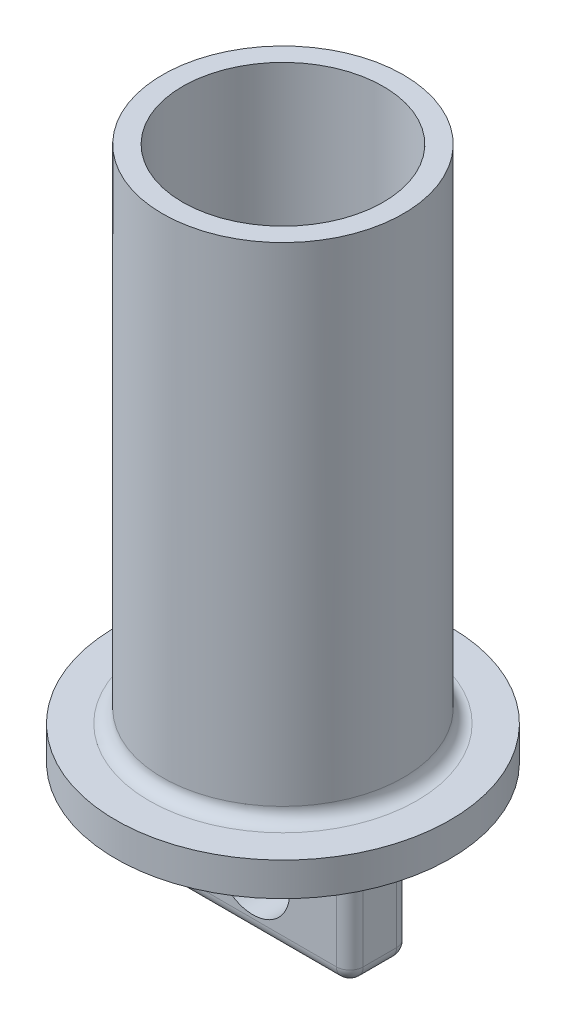
from build123d import *

# Parameters (mm, degrees)
SKETCH1_R            = 18
BOSS_EXTRUDE1_DEPTH  = 80
SKETCH1_3_R          = 15
SKETCH1_3_R_2        = 13
BOSS_EXTRUDE2_DEPTH  = 5
BOSS_EXTRUDE4_DEPTH  = 10
SKETCH3_R            = 25
SKETCH3_R_2          = 18
SKETCH3_R_3          = 13
BOSS_EXTRUDE6_DEPTH  = 5
SKETCH15_W           = 29
SKETCH15_H           = 9
BOSS_EXTRUDE13_DEPTH = 20
SKETCH16_R           = 5.5
CUT_EXTRUDE3_DEPTH   = 89.855219318
FILLET1_R            = 2


with BuildPart() as part:
    # Sketch1 → Boss-Extrude1 (new body)
    with BuildSketch(Plane(origin=(0, 0, 0), x_dir=(1, 0, 0), z_dir=(0, 1, 0))):
        Circle(SKETCH1_R)
        with BuildLine():
            ThreePointArc((-3.882285677, 14.488887394), (0, 15), (3.882285677, 14.488887394))
            ThreePointArc((3.882285677, 14.488887394), (10.606601718, 10.606601718), (14.488887394, 3.882285677))
            ThreePointArc((14.488887394, 3.882285677), (14.871672921, 1.957892883), (15, 0))
            ThreePointArc((15, 0), (14.871672921, -1.957892883), (14.488887394, -3.882285677))
            ThreePointArc((14.488887394, -3.882285677), (10.606601718, -10.606601718), (3.882285677, -14.488887394))
            ThreePointArc((3.882285677, -14.488887394), (0, -15), (-3.882285677, -14.488887394))
            ThreePointArc((-3.882285677, -14.488887394), (-10.606601718, -10.606601718), (-14.488887394, -3.882285677))
            ThreePointArc((-14.488887394, -3.882285677), (-15, 0), (-14.488887394, 3.882285677))
            ThreePointArc((-14.488887394, 3.882285677), (-10.606601718, 10.606601718), (-3.882285677, 14.488887394))
        make_face(mode=Mode.SUBTRACT)
    extrude(amount=BOSS_EXTRUDE1_DEPTH)

    # Sketch1<3> → Boss-Extrude2 (add)
    with BuildSketch(Plane(origin=(0, 0, 0), x_dir=(1, 0, 0), z_dir=(0, 1, 0))):
        Circle(SKETCH1_3_R)
        Circle(SKETCH1_3_R_2, mode=Mode.SUBTRACT)
    extrude(amount=BOSS_EXTRUDE2_DEPTH)

    # Sketch1<4> → Boss-Extrude4 (add)
    with BuildSketch(Plane(origin=(0, 0, 0), x_dir=(1, 0, 0), z_dir=(0, 1, 0))):
        with BuildLine():
            Line((3.364647586, 12.557035742), (3.882285677, 14.488887394))
            ThreePointArc((3.882285677, 14.488887394), (0, 15), (-3.882285677, 14.488887394))
            Line((-3.882285677, 14.488887394), (-3.364647586, 12.557035742))
            ThreePointArc((-3.364647586, 12.557035742), (0, 13), (3.364647586, 12.557035742))
        make_face()
        with BuildLine():
            ThreePointArc((14.488887394, -3.882285677), (15, 0), (14.488887394, 3.882285677))
            Line((14.488887394, 3.882285677), (12.557035742, 3.364647586))
            ThreePointArc((12.557035742, 3.364647586), (13, 0), (12.557035742, -3.364647586))
            Line((12.557035742, -3.364647586), (14.488887394, -3.882285677))
        make_face()
        with BuildLine():
            Line((-12.557035742, 3.364647586), (-14.488887394, 3.882285677))
            ThreePointArc((-14.488887394, 3.882285677), (-15, 0), (-14.488887394, -3.882285677))
            Line((-14.488887394, -3.882285677), (-12.557035742, -3.364647586))
            ThreePointArc((-12.557035742, -3.364647586), (-13, 0), (-12.557035742, 3.364647586))
        make_face()
        with BuildLine():
            ThreePointArc((-3.882285677, -14.488887394), (0, -15), (3.882285677, -14.488887394))
            Line((3.882285677, -14.488887394), (3.364647586, -12.557035742))
            ThreePointArc((3.364647586, -12.557035742), (0, -13), (-3.364647586, -12.557035742))
            Line((-3.364647586, -12.557035742), (-3.882285677, -14.488887394))
        make_face()
    extrude(amount=BOSS_EXTRUDE4_DEPTH)

    # Sketch3 → Boss-Extrude6 (add)
    # profile 1 of 2: a face of its own
    with BuildSketch(Plane.XZ):
        Circle(SKETCH3_R)
        Circle(SKETCH3_R_2, mode=Mode.SUBTRACT)
    # profile 2 of 2: a face of its own
    with BuildSketch(Plane.XZ):
        Circle(SKETCH3_R_3)
    extrude(amount=-BOSS_EXTRUDE6_DEPTH)

    # Sketch15 → Boss-Extrude13 (add)
    with BuildSketch(Plane.XZ):
        Rectangle(SKETCH15_W, SKETCH15_H)
    extrude(amount=BOSS_EXTRUDE13_DEPTH)

    # Sketch16 → Cut-Extrude3 (cut, through all)
    with BuildSketch(Plane.XY.offset(4.5)):
        with Locations((0, -12)):
            Circle(SKETCH16_R)
    extrude(amount=-CUT_EXTRUDE3_DEPTH, mode=Mode.SUBTRACT)

    # Fillet1
    fillet1_edges = [part.edges().sort_by_distance(p)[0] for p in [
        (0, 0, 4.5),
        (-14.5, 0, 0),
        (-14.5, -20, 0),
        (14.5, -20, 0),
        (0, -20, -4.5),
        (0, -20, 4.5),
        (14.5, -10, 4.5),
        (-14.5, -10, 4.5),
        (-14.5, -10, -4.5),
        (14.5, -10, -4.5),
        (0, 0, -4.5),
        (14.5, 0, 0),
        (-18, 5, 0),
    ]]
    fillet(fillet1_edges, radius=FILLET1_R)


solid = part.part
